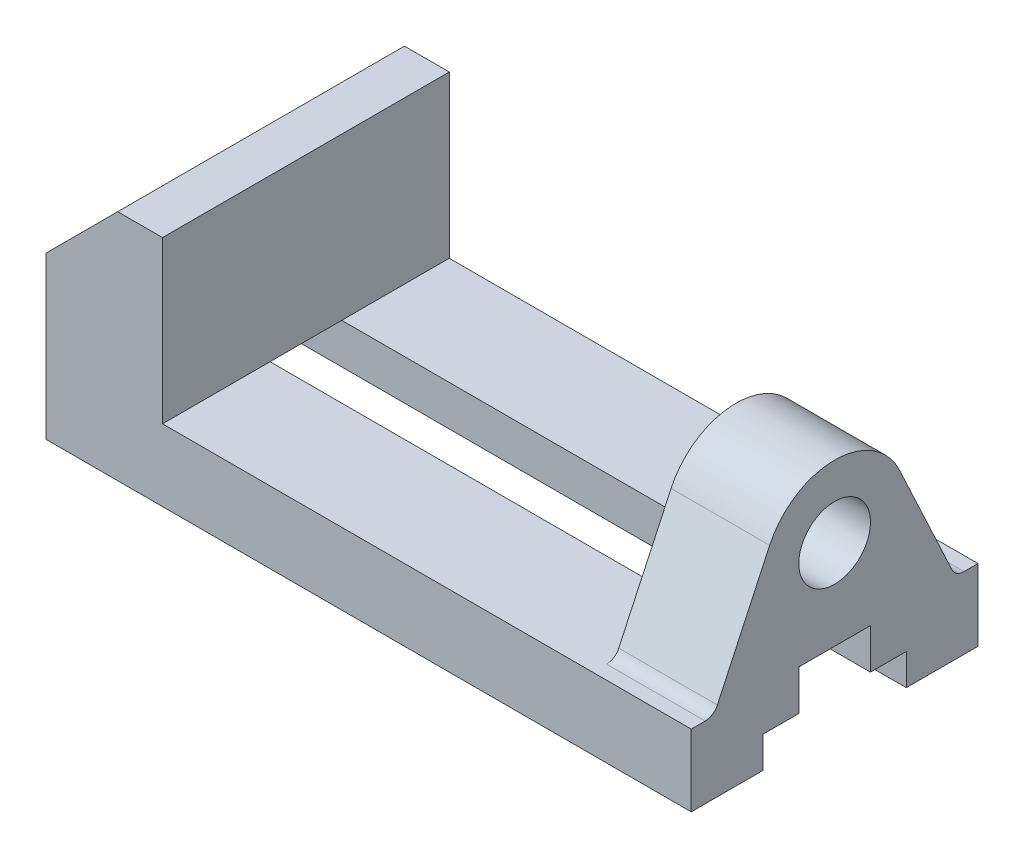
from build123d import *

# Parameters (mm, degrees)
SKETCH1_W                 = 144
SKETCH1_H                 = 64
BOSS_EXTRUDE1_DEPTH       = 16
BOSS_EXTRUDE2_DEPTH       = 64
SKETCH3_R                 = 8
BOSS_EXTRUDE3_DEPTH       = 22
FILLET1_R                 = 3
CUT_EXTRUDE1_DEPTH        = 157.409718368
M6X1_0_TAPPED_HOLE1_D     = 5
M6X1_0_TAPPED_HOLE1_DEPTH = 10
M6X1_0_TAPPED_HOLE1_TIP   = 1.443375673


with BuildPart() as part:
    # Sketch1 → Boss-Extrude1 (new body)
    with BuildSketch(Plane(origin=(0, 0, 0), x_dir=(1, 0, 0), z_dir=(0, 1, 0))):
        Rectangle(SKETCH1_W, SKETCH1_H)
    extrude(amount=BOSS_EXTRUDE1_DEPTH)

    # Sketch2 → Boss-Extrude2 (add)
    with BuildSketch(Plane.XY.offset(32)):
        Polygon((-46, 16), (-46, 52), (-56, 52), (-72, 36), (-72, 16), align=None)
    extrude(amount=-BOSS_EXTRUDE2_DEPTH)

    # Sketch3 → Boss-Extrude3 (add)
    with BuildSketch(Plane(origin=(72, 0, 0), x_dir=(0, 0, -1), z_dir=(1, 0, 0))):
        with BuildLine():
            Line((-14.500924593, 42.761892188), (-26.980199866, 16))
            Line((-26.980199866, 16), (26.980199866, 16))
            Line((26.980199866, 16), (14.500924593, 42.761892188))
            ThreePointArc((14.500924593, 42.761892188), (0, 52), (-14.500924593, 42.761892188))
        make_face()
        with Locations((0, 36)):
            Circle(SKETCH3_R, mode=Mode.SUBTRACT)
    extrude(amount=-BOSS_EXTRUDE3_DEPTH)

    # Fillet1
    fillet1_edges = [part.edges().sort_by_distance(p)[0] for p in [
        (61, 16, -26.980199866),
        (61, 16, 26.980199866),
    ]]
    fillet(fillet1_edges, radius=FILLET1_R)

    # Sketch4 → Cut-Extrude1 (cut, through all)
    with BuildSketch(Plane(origin=(72, 0, 0), x_dir=(0, 0, -1), z_dir=(1, 0, 0))):
        Polygon((-16, 0), (-16, 7), (-8, 7), (-8, 16), (8, 16), (8, 7), (16, 7), (16, 0), align=None)
    extrude(amount=-CUT_EXTRUDE1_DEPTH, mode=Mode.SUBTRACT)

    # M6x1.0 Tapped Hole1
    with Locations(Plane(origin=(0, 0, 0), x_dir=(-1, 0, 0), z_dir=(0, -1, 0))):
        with Locations((-34, -22), (36, -22), (36, 22), (-34, 22)):
            Hole(M6X1_0_TAPPED_HOLE1_D / 2, depth=M6X1_0_TAPPED_HOLE1_DEPTH)
            with Locations((0, 0, -(M6X1_0_TAPPED_HOLE1_DEPTH + M6X1_0_TAPPED_HOLE1_TIP / 2))):  # 120° drill point
                Cone(0, M6X1_0_TAPPED_HOLE1_D / 2, M6X1_0_TAPPED_HOLE1_TIP, mode=Mode.SUBTRACT)


solid = part.part
